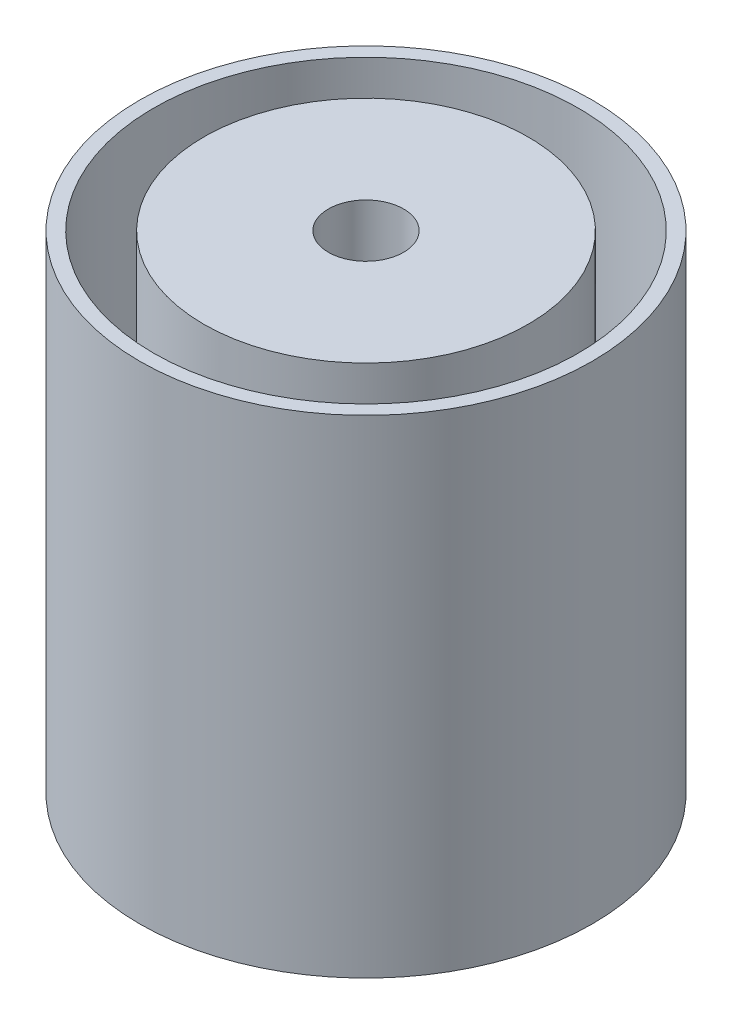
from build123d import *

# Parameters (mm, degrees)
SKETCH1_R           = 16.25
BOSS_EXTRUDE1_DEPTH = 15
SKETCH2_R           = 11.65
BOSS_EXTRUDE2_DEPTH = 20
SKETCH3_R           = 16.25
SKETCH3_R_2         = 15.25
BOSS_EXTRUDE4_DEPTH = 20
SKETCH4_R           = 2.7
CUT_EXTRUDE1_DEPTH  = 30


with BuildPart() as part:
    # Sketch1 → Boss-Extrude1 (new body)
    with BuildSketch(Plane(origin=(0, 0, 0), x_dir=(1, 0, 0), z_dir=(0, 1, 0))):
        with Locations(Location((0, 0, 0), (0, 0, 270))):
            Circle(SKETCH1_R)
    extrude(amount=BOSS_EXTRUDE1_DEPTH)

    # Sketch2 → Boss-Extrude2 (add)
    with BuildSketch(Plane(origin=(0, 15, 0), x_dir=(1, 0, 0), z_dir=(0, 1, 0))):
        with Locations(Location((0, 0, 0), (0, 0, 270))):
            Circle(SKETCH2_R)
    extrude(amount=BOSS_EXTRUDE2_DEPTH)

    # Sketch3 → Boss-Extrude4 (add)
    with BuildSketch(Plane(origin=(0, 15, 0), x_dir=(1, 0, 0), z_dir=(0, 1, 0))):
        with Locations(Location((0, 0, 0), (0, 0, 270))):
            Circle(SKETCH3_R)
        with Locations(Location((0, 0, 0), (0, 0, 270))):
            Circle(SKETCH3_R_2, mode=Mode.SUBTRACT)
    extrude(amount=BOSS_EXTRUDE4_DEPTH)

    # Sketch4 → Cut-Extrude1 (cut)
    with BuildSketch(Plane(origin=(0, 35, 0), x_dir=(1, 0, 0), z_dir=(0, 1, 0))):
        with Locations(Location((0, 0, 0), (0, 0, 270))):
            Circle(SKETCH4_R)
    extrude(amount=-CUT_EXTRUDE1_DEPTH, mode=Mode.SUBTRACT)


solid = part.part
